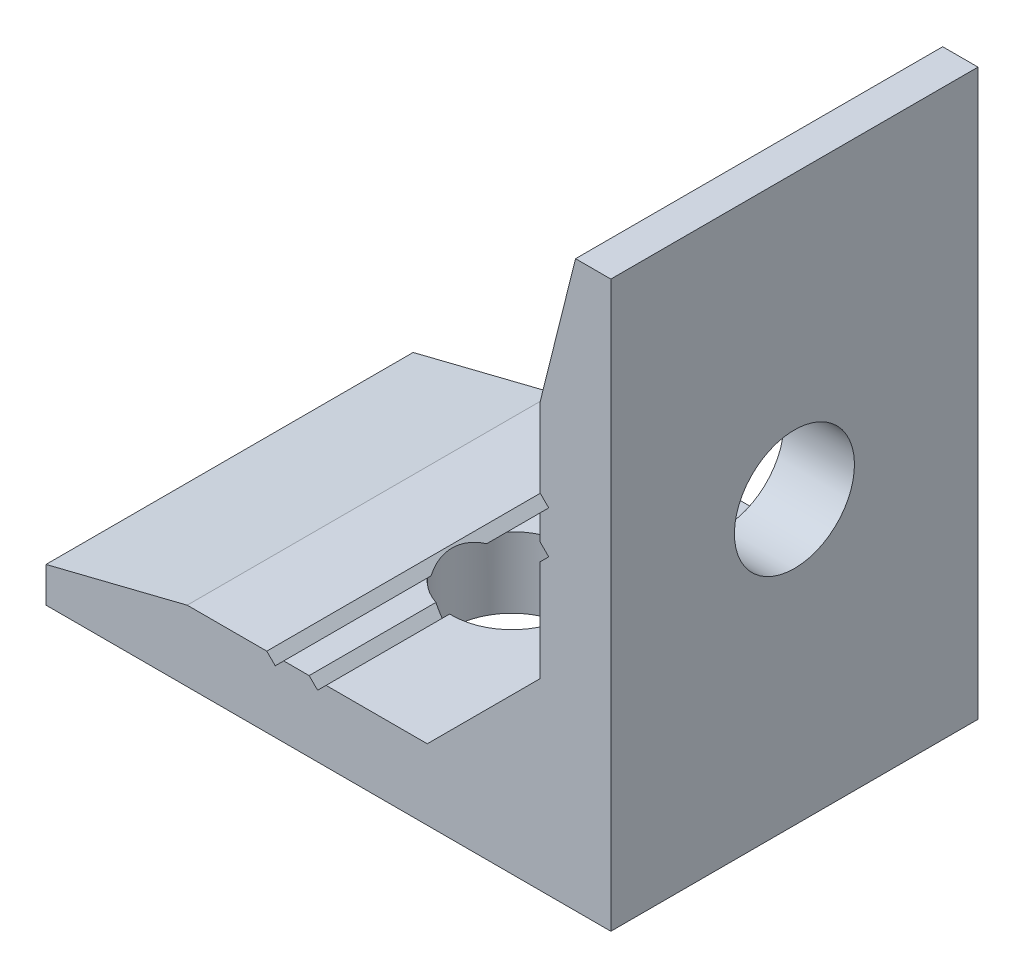
from build123d import *

# Parameters (mm, degrees)
EXTRUDE_1_DEPTH     = 13
SKETCH_3_R          = 4.25
CUT_EXTRUDE_1_DEPTH = 55.717456081
SKETCH_4_R          = 4.25
CUT_EXTRUDE_2_DEPTH = 55.717456081


with BuildPart() as part:
    # 草图1 → 凸台-拉伸1 (new, symmetric)
    with BuildSketch(Plane.XY):
        Polygon((0, 0), (40, 0), (40, 40), (37.5, 40), (35, 30), (35, 24.364950833), (35.6, 23.764950833), (35, 23.164950833), (35, 21.364950833), (35.6, 20.764950833), (35, 20.164950833), (35, 13), (27, 5), (19.835049167, 5), (19.235049167, 4.4), (18.635049167, 5), (16.835049167, 5), (16.235049167, 4.4), (15.635049167, 5), (10, 5), (0, 2.5), align=None)
    extrude(amount=EXTRUDE_1_DEPTH, both=True)

    # 草图3 → 切除-拉伸1 (cut, through all)
    with BuildSketch(Plane(origin=(0, 5, 0), x_dir=(1, 0, 0), z_dir=(0, 1, 0))):
        with Locations(Location((20, 0, 0), (0, 0, 270))):
            Circle(SKETCH_3_R)
    extrude(amount=-CUT_EXTRUDE_1_DEPTH, mode=Mode.SUBTRACT)

    # 草图4 → 切除-拉伸2 (cut, through all)
    with BuildSketch(Plane.ZY.offset(-35)):
        with Locations(Location((0, 20, 0), (0, 0, 270))):
            Circle(SKETCH_4_R)
    extrude(amount=-CUT_EXTRUDE_2_DEPTH, mode=Mode.SUBTRACT)


solid = part.part
